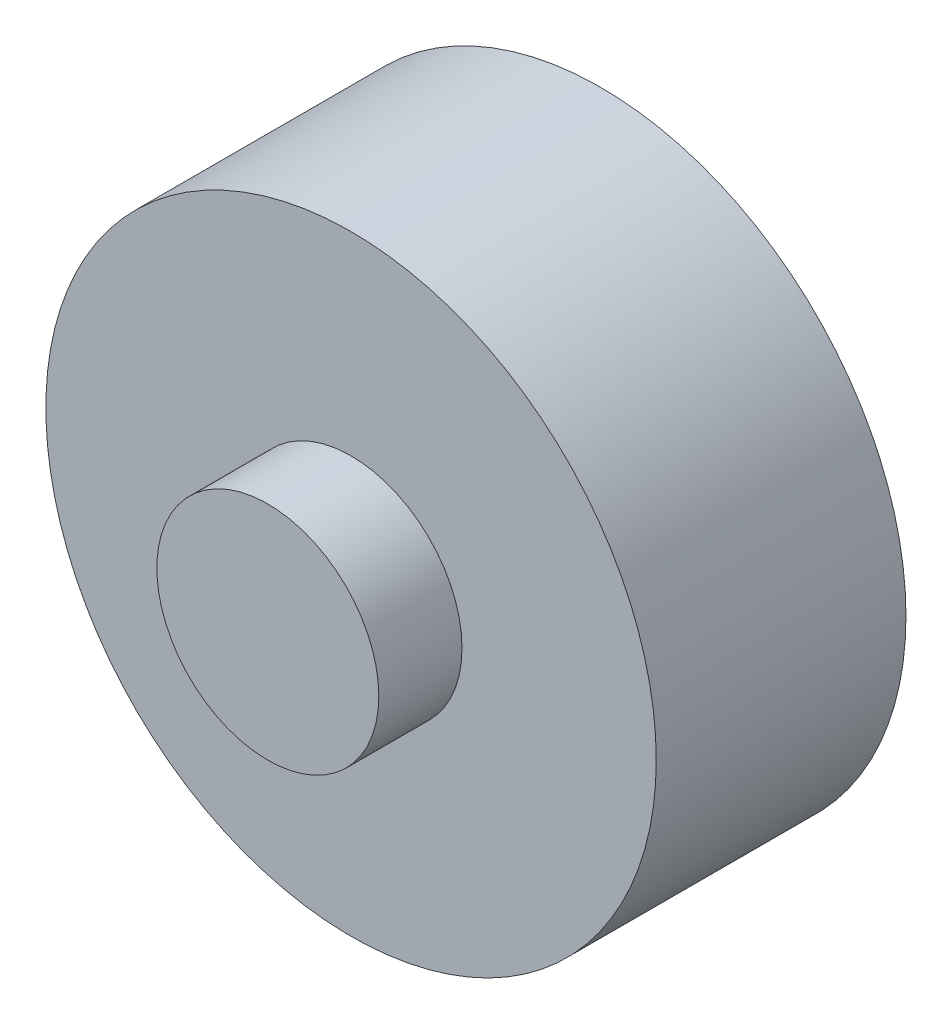
from build123d import *

# Parameters (mm, degrees)
SKETCH_1_R      = 8
EXTRUDE_1_DEPTH = 24
SKETCH_2_R      = 22
EXTRUDE_2_DEPTH = 18
SKETCH_4_R      = 8
EXTRUDE_3_DEPTH = 6


with BuildPart() as part:
    # 草图1 → 凸台-拉伸1 (new body)
    with BuildSketch(Plane.XY):
        Circle(SKETCH_1_R)
    extrude(amount=EXTRUDE_1_DEPTH)

    # 草图2 → 凸台-拉伸2 (add)
    with BuildSketch(Plane.XY):
        Circle(SKETCH_2_R)
    extrude(amount=EXTRUDE_2_DEPTH)

    # 草图4 → 凸台-拉伸3 (add)
    with BuildSketch(Plane.XY):
        Circle(SKETCH_4_R)
    extrude(amount=EXTRUDE_3_DEPTH)


solid = part.part
